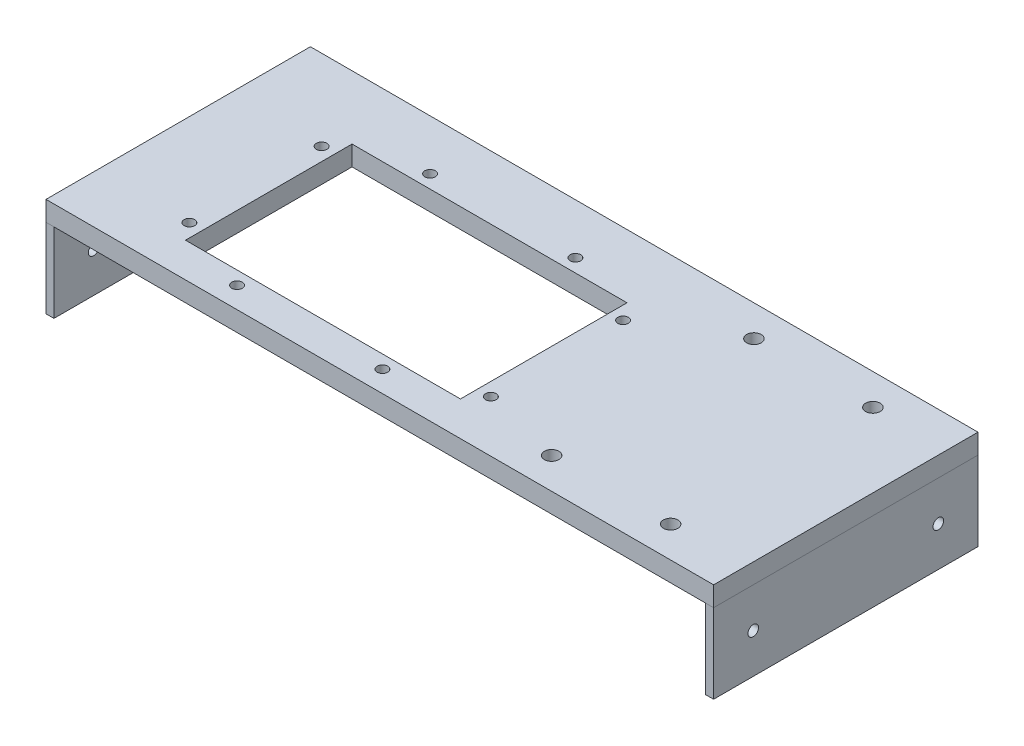
from build123d import *

# Parameters (mm, degrees)
SKETCH1_W              = 505
SKETCH1_H              = 200
SKETCH1_R              = 5.5
SKETCH1_R_2            = 4
BOSS_EXTRUDE1_DEPTH    = 15
SKETCH2_W              = 208
SKETCH2_H              = 126
SHREDDER_OPENING_DEPTH = 272.994944806
SKETCH4_W              = 6
SKETCH4_H              = 60
BOSS_EXTRUDE2_DEPTH    = 200
BOSS_EXTRUDE2_2_DEPTH  = 200
SKETCH5_R              = 4
CUT_EXTRUDE1_DEPTH     = 521.240329079


with BuildPart() as part:
    # Sketch1 → Boss-Extrude1 (new body)
    with BuildSketch(Plane(origin=(0, 0, 0), x_dir=(1, 0, 0), z_dir=(0, 1, 0))):
        Rectangle(SKETCH1_W, SKETCH1_H)
        with Locations(Location((106.5, -76.5, 0), (0, 0, 270))):
            Circle(SKETCH1_R, mode=Mode.SUBTRACT)
        with Locations(Location((196.5, -76.5, 0), (0, 0, 270))):
            Circle(SKETCH1_R, mode=Mode.SUBTRACT)
        with Locations(Location((196.5, 76.5, 0), (0, 0, 270))):
            Circle(SKETCH1_R, mode=Mode.SUBTRACT)
        with Locations(Location((106.5, 76.5, 0), (0, 0, 270))):
            Circle(SKETCH1_R, mode=Mode.SUBTRACT)
        with Locations(Location((45, -61, 0), (0, 0, 270))):
            Circle(SKETCH1_R_2, mode=Mode.SUBTRACT)
        with Locations(Location((-14, -84, 0), (0, 0, 270))):
            Circle(SKETCH1_R_2, mode=Mode.SUBTRACT)
        with Locations(Location((-124, -84, 0), (0, 0, 270))):
            Circle(SKETCH1_R_2, mode=Mode.SUBTRACT)
        with Locations(Location((-183, -61, 0), (0, 0, 270))):
            Circle(SKETCH1_R_2, mode=Mode.SUBTRACT)
        with Locations(Location((-183, 39, 0), (0, 0, 270))):
            Circle(SKETCH1_R_2, mode=Mode.SUBTRACT)
        with Locations(Location((-124, 62, 0), (0, 0, 270))):
            Circle(SKETCH1_R_2, mode=Mode.SUBTRACT)
        with Locations(Location((45, 39, 0), (0, 0, 270))):
            Circle(SKETCH1_R_2, mode=Mode.SUBTRACT)
        with Locations(Location((-14, 62, 0), (0, 0, 270))):
            Circle(SKETCH1_R_2, mode=Mode.SUBTRACT)
    extrude(amount=-BOSS_EXTRUDE1_DEPTH)

    # Sketch2 → Shredder Opening (cut, through all)
    with BuildSketch(Plane.XZ.offset(15)):
        with Locations((-69, 11)):
            Rectangle(SKETCH2_W, SKETCH2_H)
    extrude(amount=-SHREDDER_OPENING_DEPTH, mode=Mode.SUBTRACT)


with BuildPart() as body_2:
    # Sketch4 → Boss-Extrude2 (new, through all)
    with BuildSketch(Plane.XY.offset(100)):
        with Locations((-249.5, -45)):
            Rectangle(SKETCH4_W, SKETCH4_H)
    extrude(amount=-BOSS_EXTRUDE2_DEPTH)


with BuildPart() as body_3:
    # Sketch4 → Boss-Extrude2 2 (new, through all)
    with BuildSketch(Plane.XY.offset(100)):
        with Locations((249.5, -45)):
            Rectangle(SKETCH4_W, SKETCH4_H)
    extrude(amount=-BOSS_EXTRUDE2_2_DEPTH)


with BuildPart() as cut_extrude1_tool:
    # Sketch5 → Cut-Extrude1 (new, through all)
    with BuildSketch(Plane.ZY.offset(252.5)):
        with Locations((70, -45)):
            Circle(SKETCH5_R)
        with Locations((-70, -45)):
            Circle(SKETCH5_R)
    extrude(amount=-CUT_EXTRUDE1_DEPTH)


with BuildPart() as body_2_1:
    add(body_2.part)

    # Cut-Extrude1: cut by cut_extrude1_tool
    add(cut_extrude1_tool.part, mode=Mode.SUBTRACT)


with BuildPart() as body_3_1:
    add(body_3.part)

    # Cut-Extrude1: cut by cut_extrude1_tool
    add(cut_extrude1_tool.part, mode=Mode.SUBTRACT)


solid = Compound([part.part, body_2_1.part, body_3_1.part])
